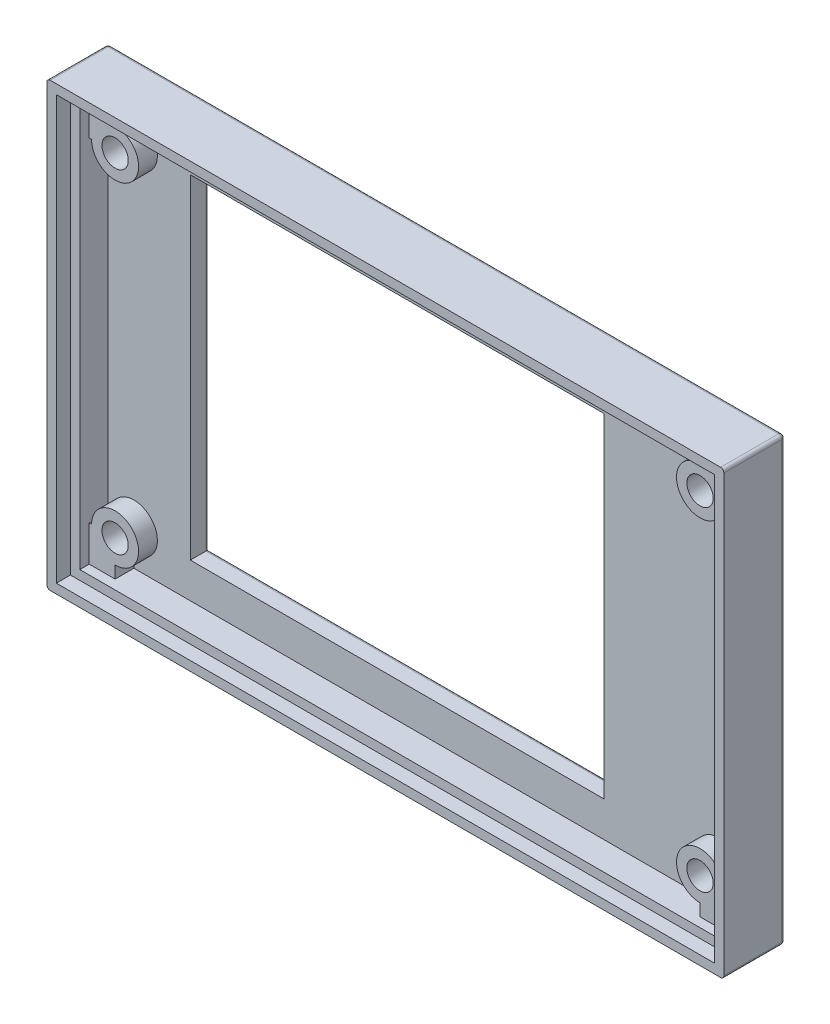
from build123d import *

# Parameters (mm, degrees)
SKETCH1_W           = 72
SKETCH1_H           = 47
BOSS_EXTRUDE1_DEPTH = 6.5
SHELL1_T            = -2
SKETCH2_W           = 44
SKETCH2_H           = 35.5
CUT_EXTRUDE1_DEPTH  = 44.479880405
SKETCH3_R           = 2.5
BOSS_EXTRUDE2_DEPTH = 2
SKETCH5_W           = 2.75
SKETCH5_H           = 3.79
SKETCH5_H_2         = 3.75
SKETCH5_W_2         = 3.04
BOSS_EXTRUDE3_DEPTH = 2
SKETCH6_R           = 1.4
CUT_EXTRUDE2_DEPTH  = 2
SKETCH7_W           = 70
SKETCH7_H           = 45
CUT_EXTRUDE3_DEPTH  = 1.5
FILLET1_R           = 0.35


with BuildPart() as part:
    # Sketch1 → Boss-Extrude1 (new body)
    with BuildSketch(Plane.XY):
        Rectangle(SKETCH1_W, SKETCH1_H)
    extrude(amount=BOSS_EXTRUDE1_DEPTH)

    # Shell1
    shell1_openings = [part.faces().sort_by_distance(p)[0] for p in [
        (0, 0, 6.5),
    ]]
    offset(amount=SHELL1_T, openings=shell1_openings, kind=Kind.INTERSECTION)

    # Sketch2 → Cut-Extrude1 (cut, through all)
    with BuildSketch(Plane(origin=(0, 0, 0), x_dir=(-1, 0, 0), z_dir=(0, 0, -1))):
        with Locations((3.25, 0)):
            Rectangle(SKETCH2_W, SKETCH2_H)
    extrude(amount=-CUT_EXTRUDE1_DEPTH, mode=Mode.SUBTRACT)

    # Sketch3 → Boss-Extrude2 (add)
    with BuildSketch(Plane.XY.offset(2)):
        with Locations((-31.25, 17.75)):
            Circle(SKETCH3_R)
        with Locations((30.96, 17.75)):
            Circle(SKETCH3_R)
        with Locations((-31.25, -17.71)):
            Circle(SKETCH3_R)
        with Locations((30.96, -17.71)):
            Circle(SKETCH3_R)
    extrude(amount=BOSS_EXTRUDE2_DEPTH)

    # Sketch5 → Boss-Extrude3 (add)
    with BuildSketch(Plane.XY.offset(2)):
        with Locations((-32.625, -19.605)):
            Rectangle(SKETCH5_W, SKETCH5_H)
        with Locations((-32.625, 19.625)):
            Rectangle(SKETCH5_W, SKETCH5_H_2)
        with Locations((32.48, 19.625)):
            Rectangle(SKETCH5_W_2, SKETCH5_H_2)
        with Locations((32.48, -19.605)):
            Rectangle(SKETCH5_W_2, SKETCH5_H)
    extrude(amount=BOSS_EXTRUDE3_DEPTH)

    # Sketch6 → Cut-Extrude2 (cut)
    with BuildSketch(Plane.XY.offset(4)):
        with Locations((-31.25, -17.71)):
            Circle(SKETCH6_R)
        with Locations((-31.25, 17.75)):
            Circle(SKETCH6_R)
        with Locations((30.96, 17.75)):
            Circle(SKETCH6_R)
        with Locations((30.96, -17.71)):
            Circle(SKETCH6_R)
    extrude(amount=-CUT_EXTRUDE2_DEPTH, mode=Mode.SUBTRACT)

    # Sketch7 → Cut-Extrude3 (cut)
    with BuildSketch(Plane.XY.offset(6.5)):
        Rectangle(SKETCH7_W, SKETCH7_H)
    extrude(amount=-CUT_EXTRUDE3_DEPTH, mode=Mode.SUBTRACT)

    # Fillet1
    fillet1_edges = [part.edges().sort_by_distance(p)[0] for p in [
        (18.75, 0, 0),
        (-3.25, -17.75, 0),
        (-25.25, 0, 0),
        (-3.25, 17.75, 0),
        (0, 23.5, 0),
        (36, 0, 0),
        (0, -23.5, 0),
        (-36, 0, 0),
        (-36, 23.5, 3.25),
        (36, 23.5, 3.25),
        (36, -23.5, 3.25),
        (-36, -23.5, 3.25),
    ]]
    fillet(fillet1_edges, radius=FILLET1_R)


solid = part.part
